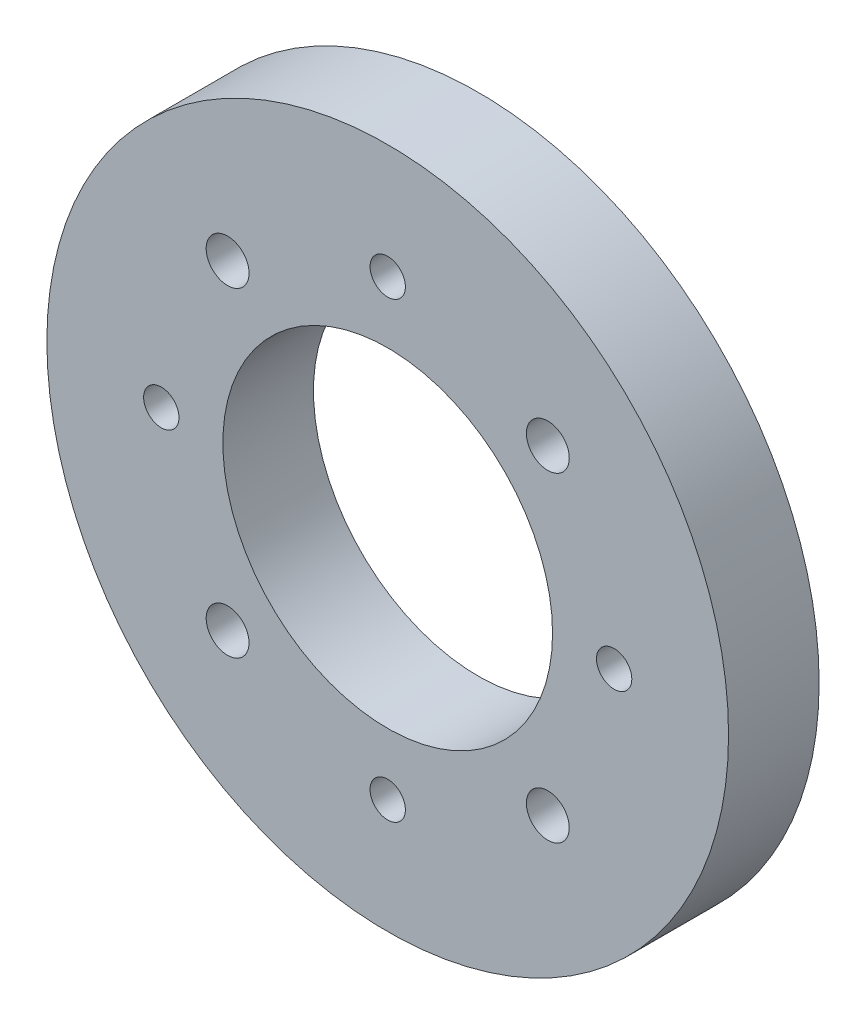
from build123d import *

# Parameters (mm, degrees)
SKETCH1_R           = 22.5
SKETCH1_R_2         = 11
SKETCH1_R_3         = 1.25
SKETCH1_R_4         = 1.5
BOSS_EXTRUDE1_DEPTH = 6
MOVE_FACE1_BY       = 0.08
MOVE_FACE1_2_BY     = 0.08
MOVE_FACE1_3_BY     = 0.08
MOVE_FACE1_4_BY     = 0.08
MOVE_FACE1_5_BY     = 0.08
MOVE_FACE1_6_BY     = 0.08
MOVE_FACE1_7_BY     = 0.08
MOVE_FACE1_8_BY     = 0.08
MOVE_FACE1_9_BY     = 0.08
MOVE_FACE1_10_BY    = 0.08


with BuildPart() as part:
    # Sketch1 → Boss-Extrude1 (new body)
    with BuildSketch(Plane.XY):
        Circle(SKETCH1_R)
        Circle(SKETCH1_R_2, mode=Mode.SUBTRACT)
        with Locations((0, 15)):
            Circle(SKETCH1_R_3, mode=Mode.SUBTRACT)
        with Locations((10.606601718, 10.606601718)):
            Circle(SKETCH1_R_4, mode=Mode.SUBTRACT)
        with Locations((15, 0)):
            Circle(SKETCH1_R_3, mode=Mode.SUBTRACT)
        with Locations((10.606601718, -10.606601718)):
            Circle(SKETCH1_R_4, mode=Mode.SUBTRACT)
        with Locations((0, -15)):
            Circle(SKETCH1_R_3, mode=Mode.SUBTRACT)
        with Locations((-10.606601718, -10.606601718)):
            Circle(SKETCH1_R_4, mode=Mode.SUBTRACT)
        with Locations((-15, 0)):
            Circle(SKETCH1_R_3, mode=Mode.SUBTRACT)
        with Locations((-10.606601718, 10.606601718)):
            Circle(SKETCH1_R_4, mode=Mode.SUBTRACT)
    extrude(amount=BOSS_EXTRUDE1_DEPTH)

    # Move Face1: a curved face moved outward by 0.08
    add(Solid.thicken(part.faces().sort_by_distance((-11, 0, 3))[0], MOVE_FACE1_BY))

    # Move Face1 2: a curved face moved outward by 0.08
    add(Solid.thicken(part.faces().sort_by_distance((-22.5, 0, 3))[0], MOVE_FACE1_2_BY))

    # Move Face1 3: a curved face moved outward by 0.08
    add(Solid.thicken(part.faces().sort_by_distance((-1.25, 15, 3))[0], MOVE_FACE1_3_BY))

    # Move Face1 4: a curved face moved outward by 0.08
    add(Solid.thicken(part.faces().sort_by_distance((9.106601718, 10.606601718, 3))[0], MOVE_FACE1_4_BY))

    # Move Face1 5: a curved face moved outward by 0.08
    add(Solid.thicken(part.faces().sort_by_distance((13.75, 0, 3))[0], MOVE_FACE1_5_BY))

    # Move Face1 6: a curved face moved outward by 0.08
    add(Solid.thicken(part.faces().sort_by_distance((9.106601718, -10.606601718, 3))[0], MOVE_FACE1_6_BY))

    # Move Face1 7: a curved face moved outward by 0.08
    add(Solid.thicken(part.faces().sort_by_distance((-1.25, -15, 3))[0], MOVE_FACE1_7_BY))

    # Move Face1 8: a curved face moved outward by 0.08
    add(Solid.thicken(part.faces().sort_by_distance((-12.106601718, -10.606601718, 3))[0], MOVE_FACE1_8_BY))

    # Move Face1 9: a curved face moved outward by 0.08
    add(Solid.thicken(part.faces().sort_by_distance((-16.25, 0, 3))[0], MOVE_FACE1_9_BY))

    # Move Face1 10: a curved face moved outward by 0.08
    add(Solid.thicken(part.faces().sort_by_distance((-12.106601718, 10.606601718, 3))[0], MOVE_FACE1_10_BY))


solid = part.part
